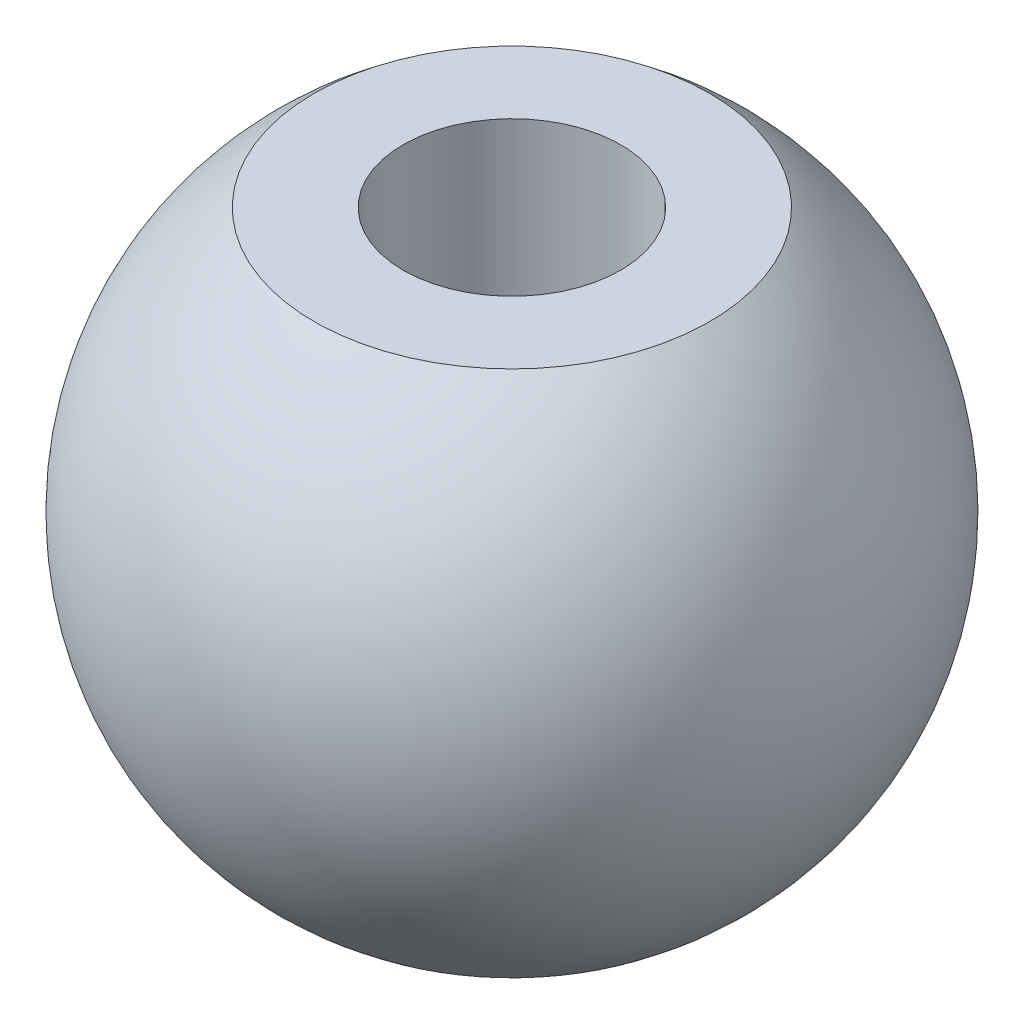
from build123d import *

# Parameters (mm, degrees)
TAP_DRILL_FOR_M4X0_7_TAP1_D     = 3.3
TAP_DRILL_FOR_M4X0_7_TAP1_DEPTH = 6
TAP_DRILL_FOR_M4X0_7_TAP1_TIP   = 0.991420021


with BuildPart() as part:
    # Sketch1 → Revolve1 (revolve)
    with BuildSketch(Plane.XY, mode=Mode.PRIVATE) as revolve1_sk:
        with BuildLine():
            Line((0, 9), (3, 9))
            ThreePointArc((3, 9), (4.74341649, 3.41886117), (0, 0))
            Line((0, 0), (0, 9))
        make_face()
    revolve(revolve1_sk.sketch.rotate(Axis((0, 0, 0), (0, 1, 0)), 180), axis=Axis((0, 0, 0), (0, 1, 0)))

    # Tap Drill for M4x0.7 Tap1
    with Locations(Plane(origin=(0, 9, 0), x_dir=(1, 0, 0), z_dir=(0, 1, 0))):
        with Locations((0, 0), (-17.99076421, 5.750523929)):
            Hole(TAP_DRILL_FOR_M4X0_7_TAP1_D / 2, depth=TAP_DRILL_FOR_M4X0_7_TAP1_DEPTH)
            with Locations((0, 0, -(TAP_DRILL_FOR_M4X0_7_TAP1_DEPTH + TAP_DRILL_FOR_M4X0_7_TAP1_TIP / 2))):  # 118° drill point
                Cone(0, TAP_DRILL_FOR_M4X0_7_TAP1_D / 2, TAP_DRILL_FOR_M4X0_7_TAP1_TIP, mode=Mode.SUBTRACT)


solid = part.part
